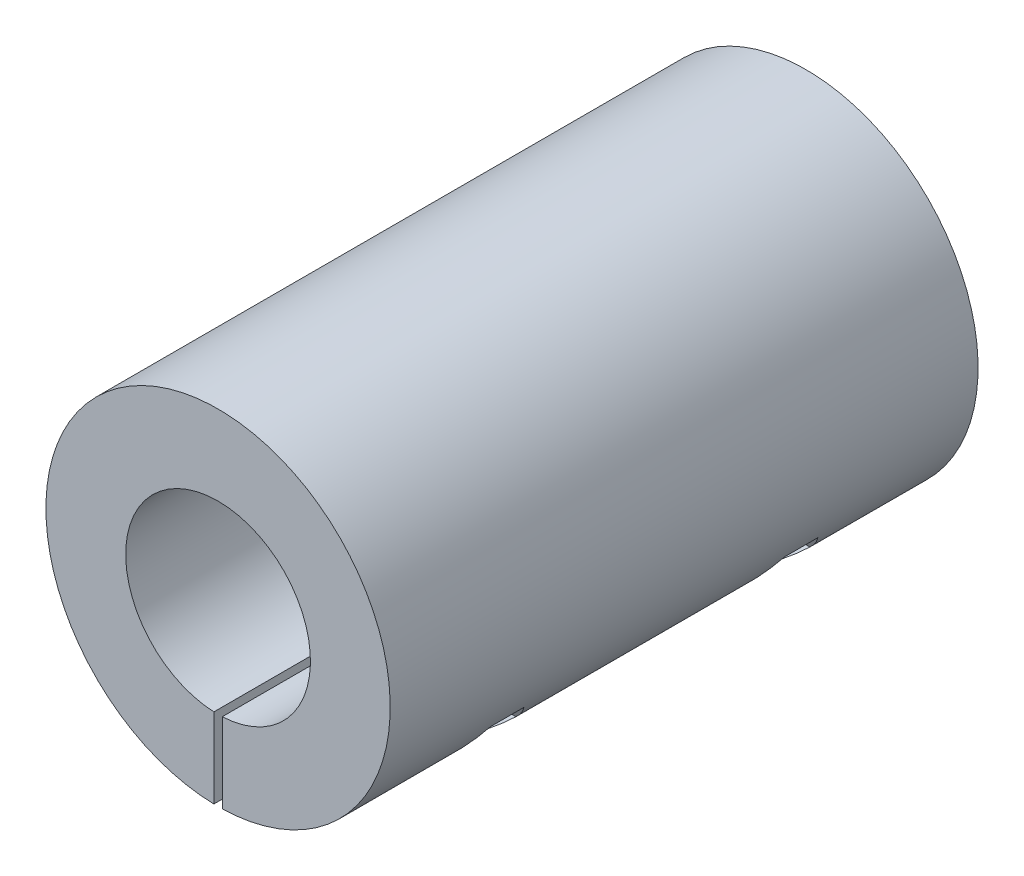
from build123d import *

# Parameters (mm, degrees)
SKETCH1_R                           = 20.5
SKETCH1_R_2                         = 11.5
BOSS_EXTRUDE1_DEPTH                 = 35
SKETCH2_R                           = 20.5
SKETCH2_R_2                         = 11
BOSS_EXTRUDE2_DEPTH                 = 35
CUT_EXTRUDE1_REACH                  = 77.766
SKETCH3_W                           = 1
SKETCH3_H                           = 20.5
CUT_EXTRUDE2_REACH                  = 77.766
CUT_EXTRUDE2_END_RADIUS             = 20.5
SKETCH4_R                           = 2
CUT_EXTRUDE2_DIRECTION_2_REACH      = 77.766
CUT_EXTRUDE2_DIRECTION_2_END_RADIUS = 20.5
CUT_EXTRUDE3_REACH                  = 78.945
CUT_EXTRUDE3_END_RADIUS             = 20.5
CUT_EXTRUDE4_REACH                  = 78.945
CUT_EXTRUDE4_END_RADIUS             = 20.5
SKETCH7_R                           = 3.6


with BuildPart() as part:
    # Sketch1 → Boss-Extrude1 (new body)
    with BuildSketch(Plane.XY):
        Circle(SKETCH1_R)
        Circle(SKETCH1_R_2, mode=Mode.SUBTRACT)
    extrude(amount=BOSS_EXTRUDE1_DEPTH)

    # Sketch2 → Boss-Extrude2 (add)
    with BuildSketch(Plane.XY.offset(35)):
        Circle(SKETCH2_R)
        Circle(SKETCH2_R_2, mode=Mode.SUBTRACT)
    extrude(amount=BOSS_EXTRUDE2_DEPTH)

    # Cut-Extrude1: up to this face of the body (flat: up to its plane)
    cut_extrude1_end = Plane(part.part.faces().sort_by_distance((-19.920172439, 0, 70))[0])
    # Sketch3 → Cut-Extrude1 (cut, up to the picked face)
    with BuildSketch(Plane(origin=(0, 0, 0), x_dir=(-1, 0, 0), z_dir=(0, 0, -1)), mode=Mode.PRIVATE) as cut_extrude1_sk1:
        with Locations((0, -10.25)):
            Rectangle(SKETCH3_W, SKETCH3_H)
    cut_extrude1_tool1 = split(extrude(cut_extrude1_sk1.sketch, amount=-CUT_EXTRUDE1_REACH, mode=Mode.PRIVATE), bisect_by=cut_extrude1_end, keep=Keep.BOTH, mode=Mode.PRIVATE)
    add(cut_extrude1_tool1.solids().sort_by(Axis((0, -10.25, 0), (0, 0, 1)))[0], mode=Mode.SUBTRACT)

    # Cut-Extrude2: up to this cylinder (the profile starts inside it)
    cut_extrude2_end = Plane(origin=(0, 0, 35), z_dir=(0, 0, -1)) * Cylinder(CUT_EXTRUDE2_END_RADIUS, 232.532, mode=Mode.PRIVATE)
    # Sketch4 → Cut-Extrude2 (cut, up to the surface)
    with BuildSketch(Plane(origin=(0, 0, 0), x_dir=(0, 0, -1), z_dir=(1, 0, 0)), mode=Mode.PRIVATE) as cut_extrude2_sk1:
        with Locations(Location((-52.5, -14.989125293, 0), (0, 0, 90))):
            Circle(SKETCH4_R)
    cut_extrude2_tool1 = extrude(cut_extrude2_sk1.sketch, amount=-CUT_EXTRUDE2_REACH, mode=Mode.PRIVATE) & cut_extrude2_end
    add(cut_extrude2_tool1.solids().sort_by_distance((0, -14.989125, 52.5))[0], mode=Mode.SUBTRACT)
    # Sketch4 → Cut-Extrude2 (cut, up to the surface)
    with BuildSketch(Plane(origin=(0, 0, 0), x_dir=(0, 0, -1), z_dir=(1, 0, 0)), mode=Mode.PRIVATE) as cut_extrude2_sk2:
        with Locations(Location((-17.5, -14.989125293, 0), (0, 0, 90))):
            Circle(SKETCH4_R)
    cut_extrude2_tool2 = extrude(cut_extrude2_sk2.sketch, amount=-CUT_EXTRUDE2_REACH, mode=Mode.PRIVATE) & cut_extrude2_end
    add(cut_extrude2_tool2.solids().sort_by_distance((0, -14.989125, 17.5))[0], mode=Mode.SUBTRACT)

    # Cut-Extrude2 direction 2: up to this cylinder (the profile starts inside it)
    cut_extrude2_direction_2_end = Plane(origin=(0, 0, 35), z_dir=(0, 0, -1)) * Cylinder(CUT_EXTRUDE2_DIRECTION_2_END_RADIUS, 232.532, mode=Mode.PRIVATE)
    # Sketch4 → Cut-Extrude2 direction 2 (cut, up to the surface)
    with BuildSketch(Plane(origin=(0, 0, 0), x_dir=(0, 0, -1), z_dir=(1, 0, 0)), mode=Mode.PRIVATE) as cut_extrude2_direction_2_sk1:
        with Locations(Location((-52.5, -14.989125293, 0), (0, 0, 90))):
            Circle(SKETCH4_R)
    cut_extrude2_direction_2_tool1 = extrude(cut_extrude2_direction_2_sk1.sketch, amount=CUT_EXTRUDE2_DIRECTION_2_REACH, mode=Mode.PRIVATE) & cut_extrude2_direction_2_end
    add(cut_extrude2_direction_2_tool1.solids().sort_by_distance((0, -14.989125, 52.5))[0], mode=Mode.SUBTRACT)
    # Sketch4 → Cut-Extrude2 direction 2 (cut, up to the surface)
    with BuildSketch(Plane(origin=(0, 0, 0), x_dir=(0, 0, -1), z_dir=(1, 0, 0)), mode=Mode.PRIVATE) as cut_extrude2_direction_2_sk2:
        with Locations(Location((-17.5, -14.989125293, 0), (0, 0, 90))):
            Circle(SKETCH4_R)
    cut_extrude2_direction_2_tool2 = extrude(cut_extrude2_direction_2_sk2.sketch, amount=CUT_EXTRUDE2_DIRECTION_2_REACH, mode=Mode.PRIVATE) & cut_extrude2_direction_2_end
    add(cut_extrude2_direction_2_tool2.solids().sort_by_distance((0, -14.989125, 17.5))[0], mode=Mode.SUBTRACT)

    # Cut-Extrude3: up to this cylinder (the profile starts inside it)
    cut_extrude3_end = Plane(origin=(0, 0, 35), z_dir=(0, 0, -1)) * Cylinder(CUT_EXTRUDE3_END_RADIUS, 234.89, mode=Mode.PRIVATE)
    # Sketch6 → Cut-Extrude3 (cut, up to the surface)
    with BuildSketch(Plane(origin=(4, 0, 0), x_dir=(0, 0, -1), z_dir=(1, 0, 0)), mode=Mode.PRIVATE) as cut_extrude3_sk1:
        Polygon((-48.516283143, -14.989125293), (-50.508141571, -11.539125293), (-54.491858429, -11.539125293), (-56.483716857, -14.989125293), (-54.491858429, -18.439125293), (-50.508141571, -18.439125293), align=None)
    cut_extrude3_tool1 = extrude(cut_extrude3_sk1.sketch, amount=CUT_EXTRUDE3_REACH, mode=Mode.PRIVATE) & cut_extrude3_end
    add(cut_extrude3_tool1.solids().sort_by_distance((4, -14.989125, 52.5))[0], mode=Mode.SUBTRACT)
    # Sketch6 → Cut-Extrude3 (cut, up to the surface)
    with BuildSketch(Plane(origin=(4, 0, 0), x_dir=(0, 0, -1), z_dir=(1, 0, 0)), mode=Mode.PRIVATE) as cut_extrude3_sk2:
        Polygon((-13.516283143, -14.989125293), (-15.508141571, -11.539125293), (-19.491858429, -11.539125293), (-21.483716857, -14.989125293), (-19.491858429, -18.439125293), (-15.508141571, -18.439125293), align=None)
    cut_extrude3_tool2 = extrude(cut_extrude3_sk2.sketch, amount=CUT_EXTRUDE3_REACH, mode=Mode.PRIVATE) & cut_extrude3_end
    add(cut_extrude3_tool2.solids().sort_by_distance((4, -14.989125, 17.5))[0], mode=Mode.SUBTRACT)

    # Cut-Extrude4: up to this cylinder (the profile starts inside it)
    cut_extrude4_end = Plane(origin=(0, 0, 35), z_dir=(0, 0, -1)) * Cylinder(CUT_EXTRUDE4_END_RADIUS, 234.89, mode=Mode.PRIVATE)
    # Sketch7 → Cut-Extrude4 (cut, up to the surface)
    with BuildSketch(Plane(origin=(-4, 0, 0), x_dir=(0, 0, -1), z_dir=(1, 0, 0)), mode=Mode.PRIVATE) as cut_extrude4_sk1:
        with Locations((-52.5, -14.989125293)):
            Circle(SKETCH7_R)
    cut_extrude4_tool1 = extrude(cut_extrude4_sk1.sketch, amount=-CUT_EXTRUDE4_REACH, mode=Mode.PRIVATE) & cut_extrude4_end
    add(cut_extrude4_tool1.solids().sort_by_distance((-4, -14.989125, 52.5))[0], mode=Mode.SUBTRACT)
    # Sketch7 → Cut-Extrude4 (cut, up to the surface)
    with BuildSketch(Plane(origin=(-4, 0, 0), x_dir=(0, 0, -1), z_dir=(1, 0, 0)), mode=Mode.PRIVATE) as cut_extrude4_sk2:
        with Locations((-17.5, -14.989125293)):
            Circle(SKETCH7_R)
    cut_extrude4_tool2 = extrude(cut_extrude4_sk2.sketch, amount=-CUT_EXTRUDE4_REACH, mode=Mode.PRIVATE) & cut_extrude4_end
    add(cut_extrude4_tool2.solids().sort_by_distance((-4, -14.989125, 17.5))[0], mode=Mode.SUBTRACT)


solid = part.part
